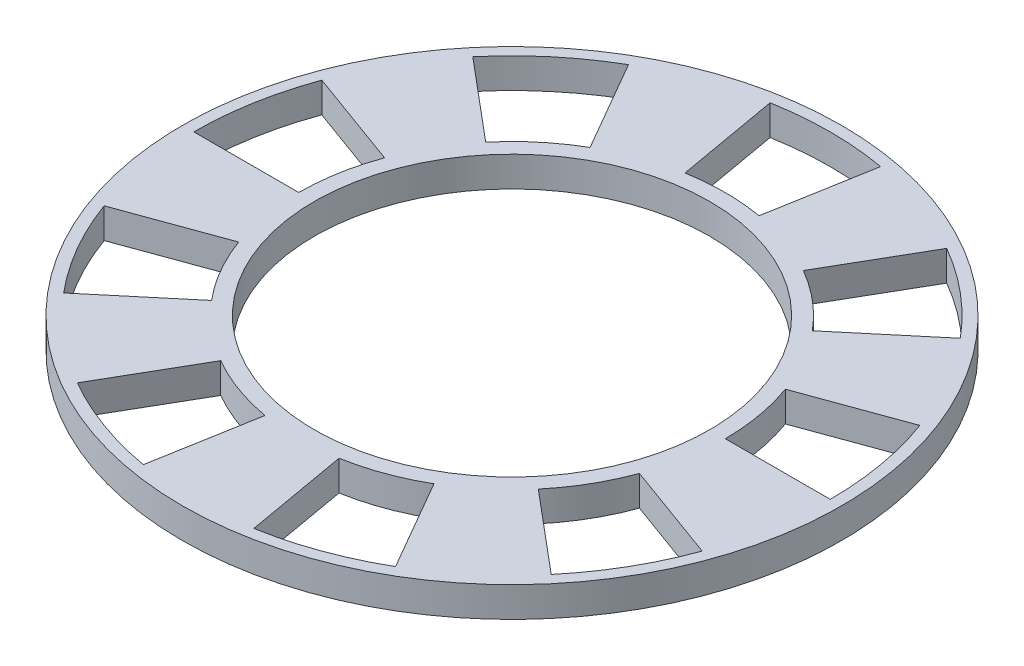
from build123d import *

# Parameters (mm, degrees)
SKETCH1_R           = 44.45
SKETCH1_R_2         = 26.67
BOSS_EXTRUDE1_DEPTH = 4.064
CUT_EXTRUDE1_REACH  = 64.993
CIRPATTERN1_COUNT   = 9


with BuildPart() as part:
    # Sketch1 → Boss-Extrude1 (new body)
    with BuildSketch(Plane(origin=(0, 0, 0), x_dir=(1, 0, 0), z_dir=(0, 1, 0))):
        with Locations(Location((0, 0, 0), (0, 0, 90))):
            Circle(SKETCH1_R)
        with Locations(Location((0, 0, 0), (0, 0, 90))):
            Circle(SKETCH1_R_2, mode=Mode.SUBTRACT)
    extrude(amount=BOSS_EXTRUDE1_DEPTH)

    # Sketch2 → Cut-Extrude1 (cut, up to next)
    with BuildSketch(Plane(origin=(0, 4.064, 0), x_dir=(1, 0, 0), z_dir=(0, 1, 0)), mode=Mode.PRIVATE) as cut_extrude1_sk1:
        with BuildLine():
            Line((-28.760847548, 0), (-42.922177943, 0))
            ThreePointArc((-42.922177943, 0), (-42.270093615, 7.453357981), (-40.333653882, 14.680249452))
            Line((-40.333653882, 14.680249452), (-27.026356208, 9.8367892))
            ThreePointArc((-27.026356208, 9.8367892), (-28.323905648, 4.994268765), (-28.760847548, 0))
        make_face()
    cut_extrude1_tool1 = extrude(cut_extrude1_sk1.sketch, amount=-CUT_EXTRUDE1_REACH, mode=Mode.PRIVATE) & part.part
    cut_extrude1 = cut_extrude1_tool1.solids().sort_by_distance((-35.574933, 4.064, -6.27282))[0]
    add(cut_extrude1, mode=Mode.SUBTRACT)

    # CirPattern1: Cut-Extrude1 ×9 about axis
    cirpattern1_axis = Axis((0, 0, 0), (0, 1, 0))
    for i in range(1, CIRPATTERN1_COUNT):
        add(cut_extrude1.rotate(cirpattern1_axis, i * 360 / CIRPATTERN1_COUNT), mode=Mode.SUBTRACT)


solid = part.part
